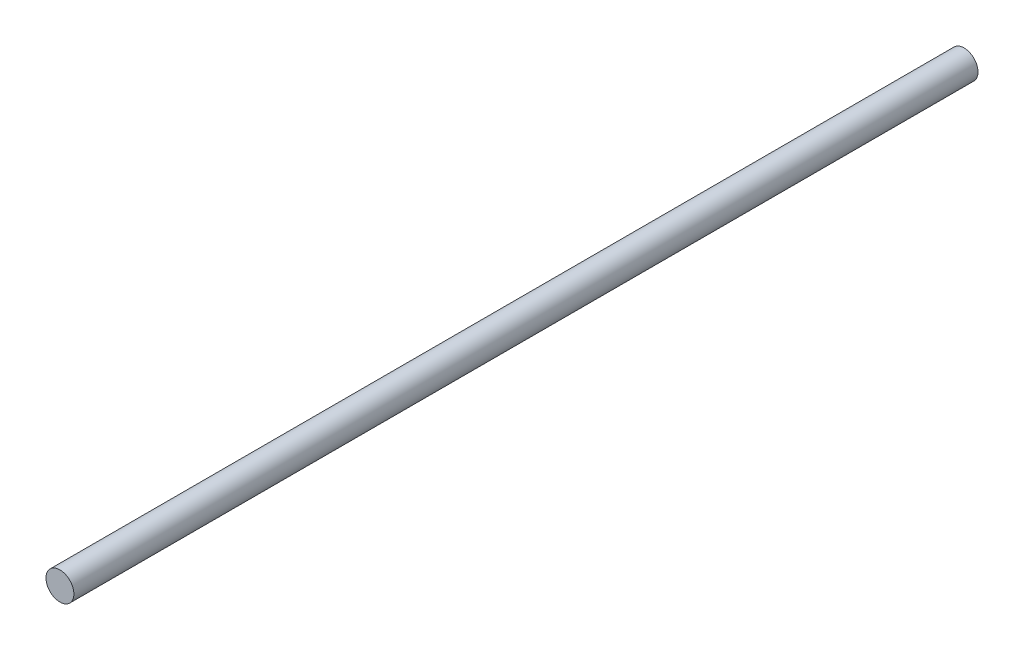
from build123d import *

# Parameters (mm, degrees)
BOSS_EXTRUDE1_START = 1
SKETCH1_R           = 5
BOSS_EXTRUDE1_DEPTH = 324


with BuildPart() as part:
    # Sketch1 → Boss-Extrude1 (new body)
    with BuildSketch(Plane.XY.offset(BOSS_EXTRUDE1_START)):
        Circle(SKETCH1_R)
    extrude(amount=BOSS_EXTRUDE1_DEPTH)


solid = part.part
